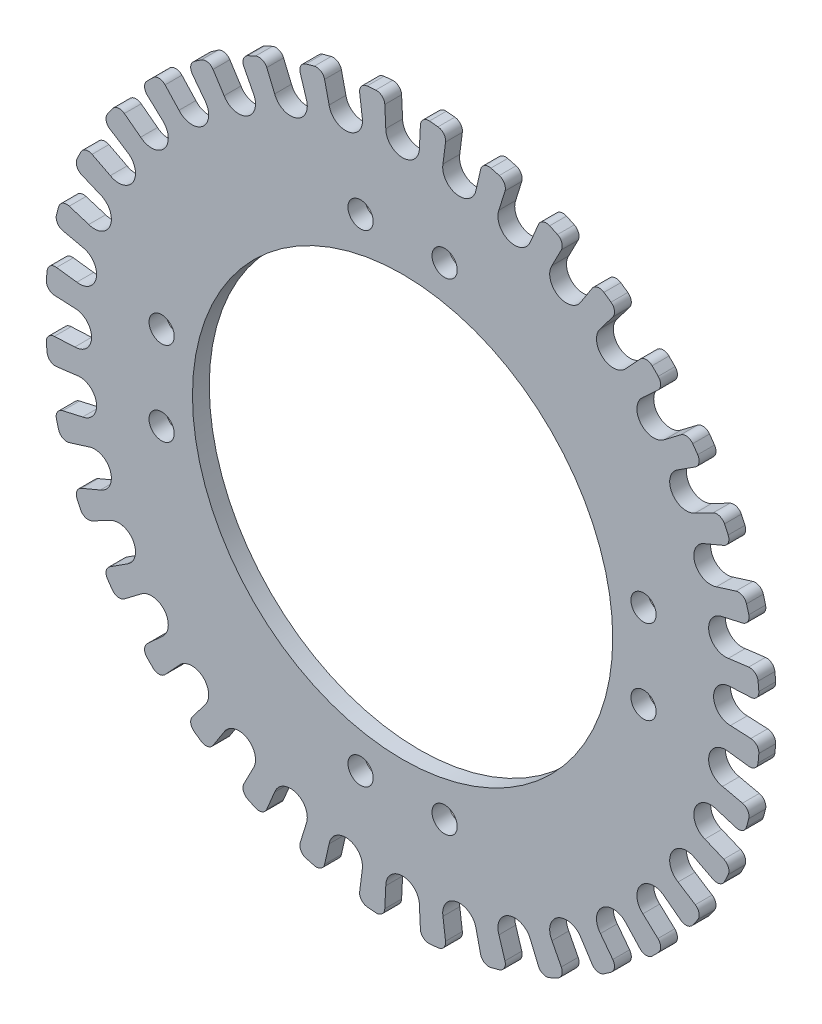
from build123d import *

# Parameters (mm, degrees)
SKETCH1_R           = 1.5
SKETCH1_R_2         = 25
BOSS_EXTRUDE1_DEPTH = 2


with BuildPart() as part:
    # Sketch1 → Boss-Extrude1 (new body)
    with BuildSketch(Plane.XY):
        with BuildLine():
            Line((5.108655879, 41.169613486), (4.802663423, 38.754798723))
            ThreePointArc((4.802663423, 38.754798723), (6.424982574, 36.437886862), (8.741894435, 38.060206012))
            Line((8.741894435, 38.060206012), (9.280270873, 40.434045209))
            ThreePointArc((9.280270873, 40.434045209), (9.733641639, 41.065896123), (10.502624756, 41.18185126))
            ThreePointArc((10.502624756, 41.18185126), (10.999809417, 41.051847617), (11.495385785, 40.915841744))
            ThreePointArc((11.495385785, 40.915841744), (12.103367131, 40.430930091), (12.180072274, 39.657045766))
            Line((12.180072274, 39.657045766), (11.459400348, 37.332052497))
            ThreePointArc((11.459400348, 37.332052497), (12.654745303, 34.768626969), (15.218170831, 35.963971924))
            Line((15.218170831, 35.963971924), (16.160580972, 38.208259082))
            ThreePointArc((16.160580972, 38.208259082), (16.716783777, 38.751783754), (17.494219711, 38.732444755))
            ThreePointArc((17.494219711, 38.732444755), (17.961276124, 38.518080949), (18.425706402, 38.298085378))
            ThreePointArc((18.425706402, 38.298085378), (18.94024712, 37.714965769), (18.881403337, 36.939518777))
            Line((18.881403337, 36.939518777), (17.767949192, 34.774990748))
            ThreePointArc((17.767949192, 34.774990748), (18.5, 32.04293994), (21.232050808, 32.774990748))
            Line((21.232050808, 32.774990748), (22.549859996, 34.821534337))
            ThreePointArc((22.549859996, 34.821534337), (23.191994899, 35.260218044), (23.954261652, 35.106172515))
            ThreePointArc((23.954261652, 35.106172515), (24.376998545, 34.813961882), (24.796171253, 34.516661067))
            ThreePointArc((24.796171253, 34.516661067), (25.201637284, 33.853051297), (25.009032513, 33.099603203))
            Line((25.009032513, 33.099603203), (23.536627892, 31.161308501))
            ThreePointArc((23.536627892, 31.161308501), (23.783141558, 28.343644395), (26.600805664, 28.590158062))
            Line((26.600805664, 28.590158062), (28.253972935, 30.376774892))
            ThreePointArc((28.253972935, 30.376774892), (28.962528992, 30.697288452), (29.686465475, 30.413216988))
            ThreePointArc((29.686465475, 30.413216988), (30.0520382, 30.0520382), (30.413216989, 29.686465475))
            ThreePointArc((30.413216989, 29.686465475), (30.697288452, 28.962528992), (30.376774892, 28.253972935))
            Line((30.376774892, 28.253972935), (28.590158062, 26.600805664))
            ThreePointArc((28.590158062, 26.600805664), (28.343644395, 23.783141558), (31.161308501, 23.536627892))
            Line((31.161308501, 23.536627892), (33.099603203, 25.009032513))
            ThreePointArc((33.099603203, 25.009032513), (33.853051297, 25.201637284), (34.516661067, 24.796171253))
            ThreePointArc((34.516661067, 24.796171253), (34.813961882, 24.376998545), (35.106172515, 23.954261653))
            ThreePointArc((35.106172515, 23.954261653), (35.260218044, 23.191994899), (34.821534338, 22.549859996))
            Line((34.821534338, 22.549859996), (32.774990748, 21.232050808))
            ThreePointArc((32.774990748, 21.232050808), (32.04293994, 18.5), (34.774990748, 17.767949192))
            Line((34.774990748, 17.767949192), (36.939518777, 18.881403337))
            ThreePointArc((36.939518777, 18.881403337), (37.714965769, 18.94024712), (38.298085378, 18.425706402))
            ThreePointArc((38.298085378, 18.425706402), (38.518080949, 17.961276124), (38.732444755, 17.494219711))
            ThreePointArc((38.732444755, 17.494219711), (38.751783754, 16.716783777), (38.208259082, 16.160580972))
            Line((38.208259082, 16.160580972), (35.963971924, 15.218170831))
            ThreePointArc((35.963971924, 15.218170831), (34.768626969, 12.654745303), (37.332052497, 11.459400348))
            Line((37.332052497, 11.459400348), (39.657045766, 12.180072274))
            ThreePointArc((39.657045766, 12.180072274), (40.430930091, 12.103367131), (40.915841744, 11.495385785))
            ThreePointArc((40.915841744, 11.495385785), (41.051847617, 10.999809417), (41.18185126, 10.502624756))
            ThreePointArc((41.18185126, 10.502624756), (41.065896123, 9.733641639), (40.434045209, 9.280270873))
            Line((40.434045209, 9.280270873), (38.060206012, 8.741894435))
            ThreePointArc((38.060206012, 8.741894435), (36.437886861, 6.424982574), (38.754798723, 4.802663423))
            Line((38.754798723, 4.802663423), (41.169613486, 5.108655879))
            ThreePointArc((41.169613486, 5.108655879), (41.918421061, 4.898732456), (42.290390964, 4.215783689))
            ThreePointArc((42.290390964, 4.215783689), (42.338274669, 3.704119067), (42.379968054, 3.191912862))
            ThreePointArc((42.379968054, 3.191912862), (42.132242019, 2.454747725), (41.431263333, 2.11798444))
            Line((41.431263333, 2.11798444), (39, 2))
            ThreePointArc((39, 2), (37, 0), (39, -2))
            Line((39, -2), (41.431263333, -2.11798444))
            ThreePointArc((41.431263333, -2.11798444), (42.132242019, -2.454747725), (42.379968054, -3.191912862))
            ThreePointArc((42.379968054, -3.191912862), (42.338274669, -3.704119067), (42.290390964, -4.215783689))
            ThreePointArc((42.290390964, -4.215783689), (41.918421061, -4.898732456), (41.169613486, -5.108655879))
            Line((41.169613486, -5.108655879), (38.754798723, -4.802663423))
            ThreePointArc((38.754798723, -4.802663423), (36.437886861, -6.424982574), (38.060206012, -8.741894435))
            Line((38.060206012, -8.741894435), (40.434045209, -9.280270873))
            ThreePointArc((40.434045209, -9.280270873), (41.065896123, -9.733641639), (41.18185126, -10.502624756))
            ThreePointArc((41.18185126, -10.502624756), (41.051847617, -10.999809417), (40.915841744, -11.495385785))
            ThreePointArc((40.915841744, -11.495385785), (40.430930091, -12.103367131), (39.657045766, -12.180072274))
            Line((39.657045766, -12.180072274), (37.332052497, -11.459400348))
            ThreePointArc((37.332052497, -11.459400348), (34.768626969, -12.654745303), (35.963971924, -15.218170831))
            Line((35.963971924, -15.218170831), (38.208259082, -16.160580972))
            ThreePointArc((38.208259082, -16.160580972), (38.751783754, -16.716783777), (38.732444755, -17.494219711))
            ThreePointArc((38.732444755, -17.494219711), (38.518080949, -17.961276124), (38.298085378, -18.425706402))
            ThreePointArc((38.298085378, -18.425706402), (37.714965769, -18.94024712), (36.939518777, -18.881403337))
            Line((36.939518777, -18.881403337), (34.774990748, -17.767949192))
            ThreePointArc((34.774990748, -17.767949192), (32.04293994, -18.5), (32.774990748, -21.232050808))
            Line((32.774990748, -21.232050808), (34.821534337, -22.549859996))
            ThreePointArc((34.821534337, -22.549859996), (35.260218044, -23.191994899), (35.106172515, -23.954261652))
            ThreePointArc((35.106172515, -23.954261652), (34.813961882, -24.376998545), (34.516661067, -24.796171253))
            ThreePointArc((34.516661067, -24.796171253), (33.853051297, -25.201637284), (33.099603203, -25.009032513))
            Line((33.099603203, -25.009032513), (31.161308501, -23.536627892))
            ThreePointArc((31.161308501, -23.536627892), (28.343644395, -23.783141558), (28.590158062, -26.600805664))
            Line((28.590158062, -26.600805664), (30.376774892, -28.253972935))
            ThreePointArc((30.376774892, -28.253972935), (30.697288452, -28.962528992), (30.413216988, -29.686465475))
            ThreePointArc((30.413216988, -29.686465475), (30.0520382, -30.0520382), (29.686465475, -30.413216989))
            ThreePointArc((29.686465475, -30.413216989), (28.962528992, -30.697288452), (28.253972935, -30.376774892))
            Line((28.253972935, -30.376774892), (26.600805664, -28.590158062))
            ThreePointArc((26.600805664, -28.590158062), (23.783141558, -28.343644395), (23.536627892, -31.161308501))
            Line((23.536627892, -31.161308501), (25.009032513, -33.099603203))
            ThreePointArc((25.009032513, -33.099603203), (25.201637284, -33.853051297), (24.796171253, -34.516661067))
            ThreePointArc((24.796171253, -34.516661067), (24.376998545, -34.813961882), (23.954261653, -35.106172515))
            ThreePointArc((23.954261653, -35.106172515), (23.191994899, -35.260218044), (22.549859996, -34.821534338))
            Line((22.549859996, -34.821534338), (21.232050808, -32.774990748))
            ThreePointArc((21.232050808, -32.774990748), (18.5, -32.04293994), (17.767949192, -34.774990748))
            Line((17.767949192, -34.774990748), (18.881403337, -36.939518777))
            ThreePointArc((18.881403337, -36.939518777), (18.94024712, -37.714965769), (18.425706402, -38.298085378))
            ThreePointArc((18.425706402, -38.298085378), (17.961276124, -38.518080949), (17.494219711, -38.732444755))
            ThreePointArc((17.494219711, -38.732444755), (16.716783777, -38.751783754), (16.160580972, -38.208259082))
            Line((16.160580972, -38.208259082), (15.218170831, -35.963971924))
            ThreePointArc((15.218170831, -35.963971924), (12.654745303, -34.768626969), (11.459400348, -37.332052497))
            Line((11.459400348, -37.332052497), (12.180072274, -39.657045766))
            ThreePointArc((12.180072274, -39.657045766), (12.103367131, -40.430930091), (11.495385785, -40.915841744))
            ThreePointArc((11.495385785, -40.915841744), (10.999809417, -41.051847617), (10.502624756, -41.18185126))
            ThreePointArc((10.502624756, -41.18185126), (9.733641639, -41.065896123), (9.280270873, -40.434045209))
            Line((9.280270873, -40.434045209), (8.741894435, -38.060206012))
            ThreePointArc((8.741894435, -38.060206012), (6.424982574, -36.437886861), (4.802663423, -38.754798723))
            Line((4.802663423, -38.754798723), (5.108655879, -41.169613486))
            ThreePointArc((5.108655879, -41.169613486), (4.898732456, -41.918421061), (4.215783689, -42.290390964))
            ThreePointArc((4.215783689, -42.290390964), (3.704119067, -42.338274669), (3.191912862, -42.379968054))
            ThreePointArc((3.191912862, -42.379968054), (2.454747725, -42.132242019), (2.11798444, -41.431263333))
            Line((2.11798444, -41.431263333), (2, -39))
            ThreePointArc((2, -39), (0, -37), (-2, -39))
            Line((-2, -39), (-2.11798444, -41.431263333))
            ThreePointArc((-2.11798444, -41.431263333), (-2.454747725, -42.132242019), (-3.191912862, -42.379968054))
            ThreePointArc((-3.191912862, -42.379968054), (-3.704119067, -42.338274669), (-4.215783689, -42.290390964))
            ThreePointArc((-4.215783689, -42.290390964), (-4.898732456, -41.918421061), (-5.108655879, -41.169613486))
            Line((-5.108655879, -41.169613486), (-4.802663423, -38.754798723))
            ThreePointArc((-4.802663423, -38.754798723), (-6.424982574, -36.437886861), (-8.741894435, -38.060206012))
            Line((-8.741894435, -38.060206012), (-9.280270873, -40.434045209))
            ThreePointArc((-9.280270873, -40.434045209), (-9.733641639, -41.065896123), (-10.502624756, -41.18185126))
            ThreePointArc((-10.502624756, -41.18185126), (-10.999809417, -41.051847617), (-11.495385785, -40.915841744))
            ThreePointArc((-11.495385785, -40.915841744), (-12.103367131, -40.430930091), (-12.180072274, -39.657045766))
            Line((-12.180072274, -39.657045766), (-11.459400348, -37.332052497))
            ThreePointArc((-11.459400348, -37.332052497), (-12.654745303, -34.768626969), (-15.218170831, -35.963971924))
            Line((-15.218170831, -35.963971924), (-16.160580972, -38.208259082))
            ThreePointArc((-16.160580972, -38.208259082), (-16.716783777, -38.751783754), (-17.494219711, -38.732444755))
            ThreePointArc((-17.494219711, -38.732444755), (-17.961276124, -38.518080949), (-18.425706402, -38.298085378))
            ThreePointArc((-18.425706402, -38.298085378), (-18.94024712, -37.714965769), (-18.881403337, -36.939518777))
            Line((-18.881403337, -36.939518777), (-17.767949192, -34.774990748))
            ThreePointArc((-17.767949192, -34.774990748), (-18.5, -32.04293994), (-21.232050808, -32.774990748))
            Line((-21.232050808, -32.774990748), (-22.549859996, -34.821534337))
            ThreePointArc((-22.549859996, -34.821534337), (-23.191994899, -35.260218044), (-23.954261652, -35.106172515))
            ThreePointArc((-23.954261652, -35.106172515), (-24.376998545, -34.813961882), (-24.796171253, -34.516661067))
            ThreePointArc((-24.796171253, -34.516661067), (-25.201637284, -33.853051297), (-25.009032513, -33.099603203))
            Line((-25.009032513, -33.099603203), (-23.536627892, -31.161308501))
            ThreePointArc((-23.536627892, -31.161308501), (-23.783141558, -28.343644395), (-26.600805664, -28.590158062))
            Line((-26.600805664, -28.590158062), (-28.253972935, -30.376774892))
            ThreePointArc((-28.253972935, -30.376774892), (-28.962528992, -30.697288452), (-29.686465475, -30.413216988))
            ThreePointArc((-29.686465475, -30.413216988), (-30.0520382, -30.0520382), (-30.413216989, -29.686465475))
            ThreePointArc((-30.413216989, -29.686465475), (-30.697288452, -28.962528992), (-30.376774892, -28.253972935))
            Line((-30.376774892, -28.253972935), (-28.590158062, -26.600805664))
            ThreePointArc((-28.590158062, -26.600805664), (-28.343644395, -23.783141558), (-31.161308501, -23.536627892))
            Line((-31.161308501, -23.536627892), (-33.099603203, -25.009032513))
            ThreePointArc((-33.099603203, -25.009032513), (-33.853051297, -25.201637284), (-34.516661067, -24.796171253))
            ThreePointArc((-34.516661067, -24.796171253), (-34.813961882, -24.376998545), (-35.106172515, -23.954261653))
            ThreePointArc((-35.106172515, -23.954261653), (-35.260218044, -23.191994899), (-34.821534338, -22.549859996))
            Line((-34.821534338, -22.549859996), (-32.774990748, -21.232050808))
            ThreePointArc((-32.774990748, -21.232050808), (-32.04293994, -18.5), (-34.774990748, -17.767949192))
            Line((-34.774990748, -17.767949192), (-36.939518777, -18.881403337))
            ThreePointArc((-36.939518777, -18.881403337), (-37.714965769, -18.94024712), (-38.298085378, -18.425706402))
            ThreePointArc((-38.298085378, -18.425706402), (-38.518080949, -17.961276124), (-38.732444755, -17.494219711))
            ThreePointArc((-38.732444755, -17.494219711), (-38.751783754, -16.716783777), (-38.208259082, -16.160580972))
            Line((-38.208259082, -16.160580972), (-35.963971924, -15.218170831))
            ThreePointArc((-35.963971924, -15.218170831), (-34.768626969, -12.654745303), (-37.332052497, -11.459400348))
            Line((-37.332052497, -11.459400348), (-39.657045766, -12.180072274))
            ThreePointArc((-39.657045766, -12.180072274), (-40.430930091, -12.103367131), (-40.915841744, -11.495385785))
            ThreePointArc((-40.915841744, -11.495385785), (-41.051847617, -10.999809417), (-41.18185126, -10.502624756))
            ThreePointArc((-41.18185126, -10.502624756), (-41.065896123, -9.733641639), (-40.434045209, -9.280270873))
            Line((-40.434045209, -9.280270873), (-38.060206012, -8.741894435))
            ThreePointArc((-38.060206012, -8.741894435), (-36.437886861, -6.424982574), (-38.754798723, -4.802663423))
            Line((-38.754798723, -4.802663423), (-41.169613486, -5.108655879))
            ThreePointArc((-41.169613486, -5.108655879), (-41.918421061, -4.898732456), (-42.290390964, -4.215783689))
            ThreePointArc((-42.290390964, -4.215783689), (-42.338274669, -3.704119067), (-42.379968054, -3.191912862))
            ThreePointArc((-42.379968054, -3.191912862), (-42.132242019, -2.454747725), (-41.431263333, -2.11798444))
            Line((-41.431263333, -2.11798444), (-39, -2))
            ThreePointArc((-39, -2), (-37, 0), (-39, 2))
            Line((-39, 2), (-41.431263333, 2.11798444))
            ThreePointArc((-41.431263333, 2.11798444), (-42.132242019, 2.454747725), (-42.379968054, 3.191912862))
            ThreePointArc((-42.379968054, 3.191912862), (-42.338274669, 3.704119067), (-42.290390964, 4.215783689))
            ThreePointArc((-42.290390964, 4.215783689), (-41.918421061, 4.898732456), (-41.169613486, 5.108655879))
            Line((-41.169613486, 5.108655879), (-38.754798723, 4.802663423))
            ThreePointArc((-38.754798723, 4.802663423), (-36.437886861, 6.424982574), (-38.060206012, 8.741894435))
            Line((-38.060206012, 8.741894435), (-40.434045209, 9.280270873))
            ThreePointArc((-40.434045209, 9.280270873), (-41.065896123, 9.733641639), (-41.18185126, 10.502624756))
            ThreePointArc((-41.18185126, 10.502624756), (-41.051847617, 10.999809417), (-40.915841744, 11.495385785))
            ThreePointArc((-40.915841744, 11.495385785), (-40.430930091, 12.103367131), (-39.657045766, 12.180072274))
            Line((-39.657045766, 12.180072274), (-37.332052497, 11.459400348))
            ThreePointArc((-37.332052497, 11.459400348), (-34.768626969, 12.654745303), (-35.963971924, 15.218170831))
            Line((-35.963971924, 15.218170831), (-38.208259082, 16.160580972))
            ThreePointArc((-38.208259082, 16.160580972), (-38.751783754, 16.716783777), (-38.732444755, 17.494219711))
            ThreePointArc((-38.732444755, 17.494219711), (-38.518080949, 17.961276124), (-38.298085378, 18.425706402))
            ThreePointArc((-38.298085378, 18.425706402), (-37.714965769, 18.94024712), (-36.939518777, 18.881403337))
            Line((-36.939518777, 18.881403337), (-34.774990748, 17.767949192))
            ThreePointArc((-34.774990748, 17.767949192), (-32.04293994, 18.5), (-32.774990748, 21.232050808))
            Line((-32.774990748, 21.232050808), (-34.821534337, 22.549859996))
            ThreePointArc((-34.821534337, 22.549859996), (-35.260218044, 23.191994899), (-35.106172515, 23.954261652))
            ThreePointArc((-35.106172515, 23.954261652), (-34.813961882, 24.376998545), (-34.516661067, 24.796171253))
            ThreePointArc((-34.516661067, 24.796171253), (-33.853051297, 25.201637284), (-33.099603203, 25.009032513))
            Line((-33.099603203, 25.009032513), (-31.161308501, 23.536627892))
            ThreePointArc((-31.161308501, 23.536627892), (-28.343644395, 23.783141558), (-28.590158062, 26.600805664))
            Line((-28.590158062, 26.600805664), (-30.376774892, 28.253972935))
            ThreePointArc((-30.376774892, 28.253972935), (-30.697288452, 28.962528992), (-30.413216988, 29.686465475))
            ThreePointArc((-30.413216988, 29.686465475), (-30.0520382, 30.0520382), (-29.686465475, 30.413216989))
            ThreePointArc((-29.686465475, 30.413216989), (-28.962528992, 30.697288452), (-28.253972935, 30.376774892))
            Line((-28.253972935, 30.376774892), (-26.600805664, 28.590158062))
            ThreePointArc((-26.600805664, 28.590158062), (-23.783141558, 28.343644395), (-23.536627892, 31.161308501))
            Line((-23.536627892, 31.161308501), (-25.009032513, 33.099603203))
            ThreePointArc((-25.009032513, 33.099603203), (-25.201637284, 33.853051297), (-24.796171253, 34.516661067))
            ThreePointArc((-24.796171253, 34.516661067), (-24.376998545, 34.813961882), (-23.954261653, 35.106172515))
            ThreePointArc((-23.954261653, 35.106172515), (-23.191994899, 35.260218044), (-22.549859996, 34.821534338))
            Line((-22.549859996, 34.821534338), (-21.232050808, 32.774990748))
            ThreePointArc((-21.232050808, 32.774990748), (-18.5, 32.04293994), (-17.767949192, 34.774990748))
            Line((-17.767949192, 34.774990748), (-18.881403337, 36.939518777))
            ThreePointArc((-18.881403337, 36.939518777), (-18.94024712, 37.714965769), (-18.425706402, 38.298085378))
            ThreePointArc((-18.425706402, 38.298085378), (-17.961276124, 38.518080949), (-17.494219711, 38.732444755))
            ThreePointArc((-17.494219711, 38.732444755), (-16.716783777, 38.751783754), (-16.160580972, 38.208259082))
            Line((-16.160580972, 38.208259082), (-15.218170831, 35.963971924))
            ThreePointArc((-15.218170831, 35.963971924), (-12.654745303, 34.768626969), (-11.459400348, 37.332052497))
            Line((-11.459400348, 37.332052497), (-12.180072274, 39.657045766))
            ThreePointArc((-12.180072274, 39.657045766), (-12.103367131, 40.430930091), (-11.495385785, 40.915841744))
            ThreePointArc((-11.495385785, 40.915841744), (-10.999809417, 41.051847617), (-10.502624756, 41.18185126))
            ThreePointArc((-10.502624756, 41.18185126), (-9.733641639, 41.065896123), (-9.280270873, 40.434045209))
            Line((-9.280270873, 40.434045209), (-8.741894435, 38.060206012))
            ThreePointArc((-8.741894435, 38.060206012), (-6.424982574, 36.437886861), (-4.802663423, 38.754798723))
            Line((-4.802663423, 38.754798723), (-5.108655879, 41.169613486))
            ThreePointArc((-5.108655879, 41.169613486), (-4.898732456, 41.918421061), (-4.215783689, 42.290390964))
            ThreePointArc((-4.215783689, 42.290390964), (-3.704119067, 42.338274669), (-3.191912862, 42.379968054))
            ThreePointArc((-3.191912862, 42.379968054), (-2.454747725, 42.132242019), (-2.11798444, 41.431263333))
            Line((-2.11798444, 41.431263333), (-2, 39))
            ThreePointArc((-2, 39), (0, 37), (2, 39))
            Line((2, 39), (2.11798444, 41.431263333))
            ThreePointArc((2.11798444, 41.431263333), (2.454747725, 42.132242019), (3.191912862, 42.379968054))
            ThreePointArc((3.191912862, 42.379968054), (3.704119067, 42.338274669), (4.215783689, 42.290390964))
            ThreePointArc((4.215783689, 42.290390964), (4.898732456, 41.918421061), (5.108655879, 41.169613486))
        make_face()
        with Locations((-28.665374196, -5)):
            Circle(SKETCH1_R, mode=Mode.SUBTRACT)
        with Locations((5, -28.665374196)):
            Circle(SKETCH1_R, mode=Mode.SUBTRACT)
        with Locations((28.665374196, 5)):
            Circle(SKETCH1_R, mode=Mode.SUBTRACT)
        with Locations((-5, 28.665374196)):
            Circle(SKETCH1_R, mode=Mode.SUBTRACT)
        Circle(SKETCH1_R_2, mode=Mode.SUBTRACT)
        with Locations((5, 28.665374196)):
            Circle(SKETCH1_R, mode=Mode.SUBTRACT)
        with Locations((28.665374196, -5)):
            Circle(SKETCH1_R, mode=Mode.SUBTRACT)
        with Locations((-5, -28.665374196)):
            Circle(SKETCH1_R, mode=Mode.SUBTRACT)
        with Locations((-28.665374196, 5)):
            Circle(SKETCH1_R, mode=Mode.SUBTRACT)
    extrude(amount=BOSS_EXTRUDE1_DEPTH)


solid = part.part
